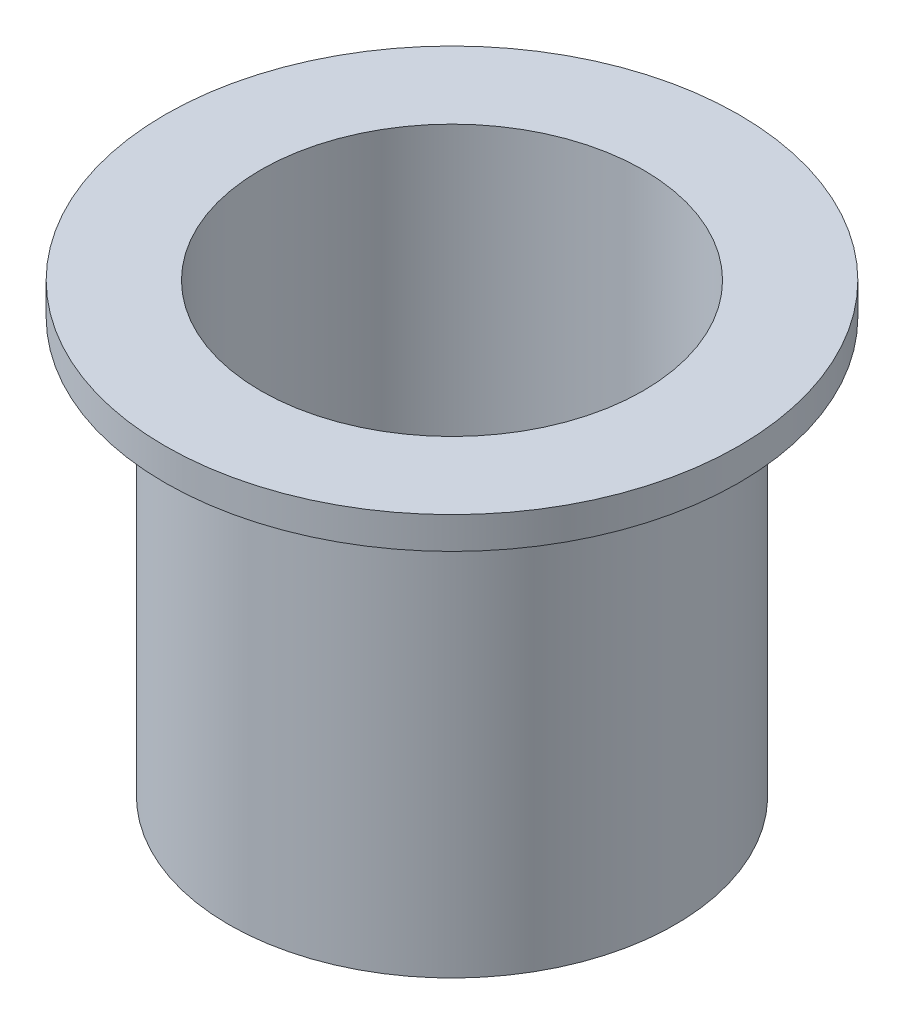
from build123d import *

# Parameters (mm, degrees)
SKETCH1_R           = 7
BOSS_EXTRUDE1_DEPTH = 13
SHELL2_T            = -1
SKETCH2_R           = 2.5
CUT_EXTRUDE1_DEPTH  = 10
SKETCH3_R           = 9
BOSS_EXTRUDE2_DEPTH = 1
CUT_EXTRUDE2_START  = -2
SKETCH4_R           = 6
CUT_EXTRUDE2_DEPTH  = 2


with BuildPart() as part:
    # Sketch1 → Boss-Extrude1 (new body)
    with BuildSketch(Plane(origin=(0, 0, 0), x_dir=(1, 0, 0), z_dir=(0, 1, 0))):
        with Locations(Location((0, 0, 0), (0, 0, 90))):
            Circle(SKETCH1_R)
    extrude(amount=BOSS_EXTRUDE1_DEPTH)

    # Shell2
    shell2_openings = [part.faces().sort_by_distance(p)[0] for p in [
        (0, 13, 0),
    ]]
    offset(amount=SHELL2_T, openings=shell2_openings, kind=Kind.INTERSECTION)

    # Sketch2 → Cut-Extrude1 (cut)
    with BuildSketch(Plane.XZ):
        with Locations(Location((0, 0, 0), (0, 0, 270))):
            Circle(SKETCH2_R)
    extrude(amount=-CUT_EXTRUDE1_DEPTH, mode=Mode.SUBTRACT)

    # Sketch3 → Boss-Extrude2 (add)
    with BuildSketch(Plane(origin=(0, 13, 0), x_dir=(1, 0, 0), z_dir=(0, 1, 0))):
        with Locations(Location((0, 0, 0), (0, 0, 270))):
            Circle(SKETCH3_R)
    extrude(amount=BOSS_EXTRUDE2_DEPTH)

    # Sketch4 → Cut-Extrude2 (cut)
    with BuildSketch(Plane(origin=(0, 14, 0), x_dir=(1, 0, 0), z_dir=(0, 1, 0)).offset(CUT_EXTRUDE2_START)):
        with Locations(Location((0, 0, 0), (0, 0, 90))):
            Circle(SKETCH4_R)
    extrude(amount=CUT_EXTRUDE2_DEPTH, mode=Mode.SUBTRACT)


solid = part.part
